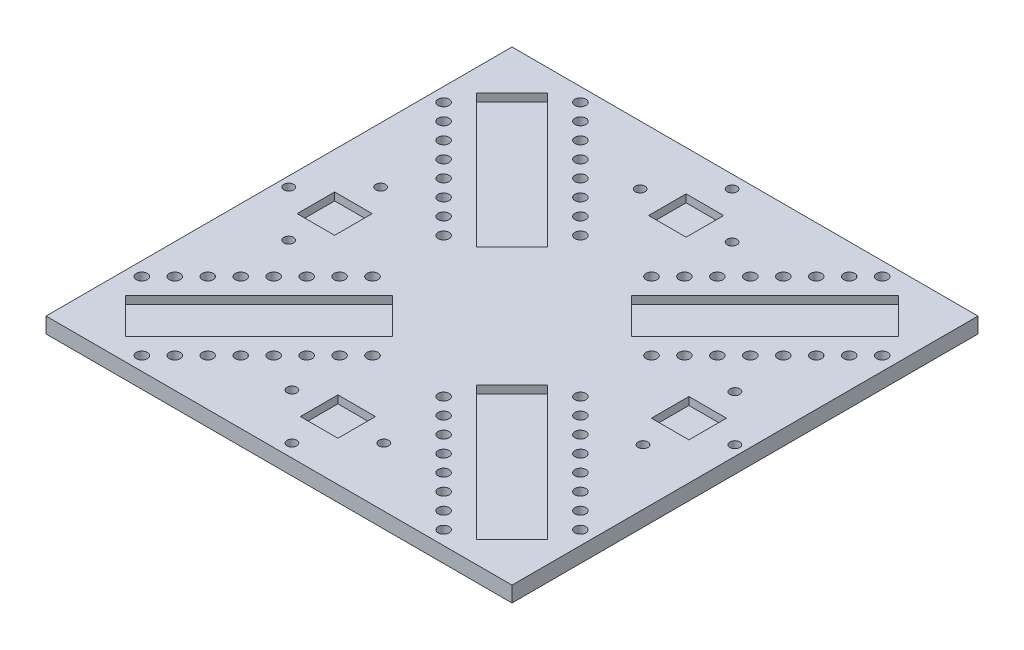
from build123d import *

# Parameters (mm, degrees)
SKETCH1_W           = 381
SKETCH1_H           = 12.7
BOSS_EXTRUDE1_DEPTH = 381
CUT_EXTRUDE1_DEPTH  = 6.35
SKETCH3_R           = 4.5
CUT_EXTRUDE2_DEPTH  = 539.965017418
SKETCH4_W           = 30.7
SKETCH4_H           = 30.7
CUT_EXTRUDE3_DEPTH  = 6.35
SKETCH5_R           = 4
CUT_EXTRUDE4_DEPTH  = 539.965017418
SKETCH6_R           = 4.5
CUT_EXTRUDE5_DEPTH  = 6.35
SKETCH8_R           = 4.5
CUT_EXTRUDE6_DEPTH  = 539.965017418


with BuildPart() as part:
    # Sketch1 → Boss-Extrude1 (new body)
    with BuildSketch(Plane.XY):
        with Locations((190.5, 6.35)):
            Rectangle(SKETCH1_W, SKETCH1_H)
    extrude(amount=BOSS_EXTRUDE1_DEPTH)

    # Sketch2 → Cut-Extrude1 (cut)
    with BuildSketch(Plane(origin=(0, 12.7, 0), x_dir=(1, 0, 0), z_dir=(0, 1, 0))):
        Polygon((17.951803255, -334.056818716), (46.943181284, -363.048196745), (127.765486373, -282.225891656), (98.774108344, -253.234513627), align=None)
        Polygon((282.225891656, -253.234513627), (253.234513627, -282.225891656), (334.056818716, -363.048196745), (363.048196745, -334.056818716), align=None)
        Polygon((363.048196745, -46.943181284), (282.225891656, -127.765486373), (253.234513627, -98.774108344), (334.056818716, -17.951803255), align=None)
        Polygon((98.774108344, -127.765486373), (127.765486373, -98.774108344), (46.943181284, -17.951803255), (17.951803255, -46.943181284), align=None)
    extrude(amount=-CUT_EXTRUDE1_DEPTH, mode=Mode.SUBTRACT)

    # Sketch3 → Cut-Extrude2 (cut, through all)
    with BuildSketch(Plane(origin=(0, 12.7, 0), x_dir=(1, 0, 0), z_dir=(0, 1, 0))):
        with Locations(Location((121.030294282, -315.90185211, 0), (0, 0, 270))):
            Circle(SKETCH3_R)
        with Locations(Location((107.559910101, -329.372236291, 0), (0, 0, 90))):
            Circle(SKETCH3_R)
        with Locations(Location((67.148757556, -369.783388836, 0), (0, 0, 270))):
            Circle(SKETCH3_R)
        with Locations(Location((134.500678464, -302.431467928, 0), (0, 0, 90))):
            Circle(SKETCH3_R)
        with Locations(Location((80.619141738, -356.313004654, 0), (0, 0, 90))):
            Circle(SKETCH3_R)
        with Locations(Location((94.089525919, -342.842620473, 0), (0, 0, 270))):
            Circle(SKETCH3_R)
        with Locations(Location((11.216611164, -313.851242444, 0), (0, 0, 90))):
            Circle(SKETCH3_R)
        with Locations(Location((24.686995346, -300.380858262, 0), (0, 0, 270))):
            Circle(SKETCH3_R)
        with Locations(Location((38.157379527, -286.910474081, 0), (0, 0, 90))):
            Circle(SKETCH3_R)
        with Locations(Location((51.627763709, -273.440089899, 0), (0, 0, 270))):
            Circle(SKETCH3_R)
        with Locations(Location((65.09814789, -259.969705718, 0), (0, 0, 90))):
            Circle(SKETCH3_R)
        with Locations(Location((78.568532072, -246.499321536, 0), (0, 0, 270))):
            Circle(SKETCH3_R)
        with Locations(Location((246.499321536, -302.431467928, 0), (0, 0, 270))):
            Circle(SKETCH3_R)
        with Locations(Location((259.969705718, -315.90185211, 0), (0, 0, 90))):
            Circle(SKETCH3_R)
        with Locations(Location((273.440089899, -329.372236291, 0), (0, 0, 270))):
            Circle(SKETCH3_R)
        with Locations(Location((286.910474081, -342.842620473, 0), (0, 0, 90))):
            Circle(SKETCH3_R)
        with Locations(Location((300.380858262, -356.313004654, 0), (0, 0, 270))):
            Circle(SKETCH3_R)
        with Locations(Location((313.851242444, -369.783388836, 0), (0, 0, 90))):
            Circle(SKETCH3_R)
        with Locations(Location((369.783388836, -313.851242444, 0), (0, 0, 270))):
            Circle(SKETCH3_R)
        with Locations(Location((302.431467928, -246.499321536, 0), (0, 0, 90))):
            Circle(SKETCH3_R)
        with Locations(Location((315.90185211, -259.969705718, 0), (0, 0, 270))):
            Circle(SKETCH3_R)
        with Locations(Location((329.372236291, -273.440089899, 0), (0, 0, 90))):
            Circle(SKETCH3_R)
        with Locations(Location((342.842620473, -286.910474081, 0), (0, 0, 270))):
            Circle(SKETCH3_R)
        with Locations(Location((356.313004654, -300.380858262, 0), (0, 0, 90))):
            Circle(SKETCH3_R)
        with Locations(Location((134.500678464, -78.568532072, 0), (0, 0, 270))):
            Circle(SKETCH3_R)
        with Locations(Location((121.030294282, -65.09814789, 0), (0, 0, 90))):
            Circle(SKETCH3_R)
        with Locations(Location((107.559910101, -51.627763709, 0), (0, 0, 270))):
            Circle(SKETCH3_R)
        with Locations(Location((94.089525919, -38.157379527, 0), (0, 0, 90))):
            Circle(SKETCH3_R)
        with Locations(Location((80.619141738, -24.686995346, 0), (0, 0, 270))):
            Circle(SKETCH3_R)
        with Locations(Location((67.148757556, -11.216611164, 0), (0, 0, 90))):
            Circle(SKETCH3_R)
        with Locations(Location((78.568532072, -134.500678464, 0), (0, 0, 90))):
            Circle(SKETCH3_R)
        with Locations(Location((65.09814789, -121.030294282, 0), (0, 0, 270))):
            Circle(SKETCH3_R)
        with Locations(Location((51.627763709, -107.559910101, 0), (0, 0, 90))):
            Circle(SKETCH3_R)
        with Locations(Location((38.157379527, -94.089525919, 0), (0, 0, 270))):
            Circle(SKETCH3_R)
        with Locations(Location((24.686995346, -80.619141738, 0), (0, 0, 90))):
            Circle(SKETCH3_R)
        with Locations(Location((11.216611164, -67.148757556, 0), (0, 0, 270))):
            Circle(SKETCH3_R)
        with Locations(Location((356.313004654, -80.619141738, 0), (0, 0, 270))):
            Circle(SKETCH3_R)
        with Locations(Location((342.842620473, -94.089525919, 0), (0, 0, 90))):
            Circle(SKETCH3_R)
        with Locations(Location((329.372236291, -107.559910101, 0), (0, 0, 270))):
            Circle(SKETCH3_R)
        with Locations(Location((315.90185211, -121.030294282, 0), (0, 0, 90))):
            Circle(SKETCH3_R)
        with Locations(Location((302.431467928, -134.500678464, 0), (0, 0, 270))):
            Circle(SKETCH3_R)
        with Locations(Location((369.783388836, -67.148757556, 0), (0, 0, 90))):
            Circle(SKETCH3_R)
        with Locations(Location((313.851242444, -11.216611164, 0), (0, 0, 270))):
            Circle(SKETCH3_R)
        with Locations(Location((300.380858262, -24.686995346, 0), (0, 0, 90))):
            Circle(SKETCH3_R)
        with Locations(Location((286.910474081, -38.157379527, 0), (0, 0, 270))):
            Circle(SKETCH3_R)
        with Locations(Location((273.440089899, -51.627763709, 0), (0, 0, 90))):
            Circle(SKETCH3_R)
        with Locations(Location((259.969705718, -65.09814789, 0), (0, 0, 270))):
            Circle(SKETCH3_R)
        with Locations(Location((246.499321536, -78.568532072, 0), (0, 0, 90))):
            Circle(SKETCH3_R)
    extrude(amount=-CUT_EXTRUDE2_DEPTH, mode=Mode.SUBTRACT)

    # Sketch4 → Cut-Extrude3 (cut)
    with BuildSketch(Plane(origin=(0, 12.7, 0), x_dir=(1, 0, 0), z_dir=(0, 1, 0))):
        with Locations((335.15, -190.5)):
            Rectangle(SKETCH4_W, SKETCH4_H)
        with Locations((190.5, -48.15)):
            Rectangle(SKETCH4_W, SKETCH4_H)
        with Locations((190.5, -332.85)):
            Rectangle(SKETCH4_W, SKETCH4_H)
        with Locations((45.5, -190.5)):
            Rectangle(SKETCH4_W, SKETCH4_H)
    extrude(amount=-CUT_EXTRUDE3_DEPTH, mode=Mode.SUBTRACT)

    # Sketch5 → Cut-Extrude4 (cut, through all)
    with BuildSketch(Plane(origin=(0, 12.7, 0), x_dir=(1, 0, 0), z_dir=(0, 1, 0))):
        with Locations(Location((335.15, -152.925, 0), (0, 0, 270))):
            Circle(SKETCH5_R)
        with Locations(Location((335.15, -228.075, 0), (0, 0, 90))):
            Circle(SKETCH5_R)
        with Locations(Location((228.075, -48.15, 0), (0, 0, 270))):
            Circle(SKETCH5_R)
        with Locations(Location((152.925, -48.15, 0), (0, 0, 90))):
            Circle(SKETCH5_R)
        with Locations(Location((372.725, -190.5, 0), (0, 0, 270))):
            Circle(SKETCH5_R)
        with Locations(Location((190.5, -10.575, 0), (0, 0, 270))):
            Circle(SKETCH5_R)
        with Locations(Location((228.075, -332.85, 0), (0, 0, 90))):
            Circle(SKETCH5_R)
        with Locations(Location((152.925, -332.85, 0), (0, 0, 270))):
            Circle(SKETCH5_R)
        with Locations(Location((190.5, -370.425, 0), (0, 0, 90))):
            Circle(SKETCH5_R)
        with Locations(Location((45.5, -152.925, 0), (0, 0, 270))):
            Circle(SKETCH5_R)
        with Locations(Location((7.925, -190.5, 0), (0, 0, 270))):
            Circle(SKETCH5_R)
        with Locations(Location((45.5, -228.075, 0), (0, 0, 90))):
            Circle(SKETCH5_R)
    extrude(amount=-CUT_EXTRUDE4_DEPTH, mode=Mode.SUBTRACT)

    # Sketch6 → Cut-Extrude5 (cut)
    with BuildSketch(Plane(origin=(0, 12.7, 0), x_dir=(1, 0, 0), z_dir=(0, 1, 0))):
        with Locations(Location((147.971062646, -288.961083746, 0), (0, 0, 90))):
            Circle(SKETCH6_R)
        with Locations(Location((161.441446827, -275.490699565, 0), (0, 0, 270))):
            Circle(SKETCH6_R)
        with Locations(Location((105.509300435, -219.558553173, 0), (0, 0, 90))):
            Circle(SKETCH6_R)
        with Locations(Location((92.038916254, -233.028937354, 0), (0, 0, 270))):
            Circle(SKETCH6_R)
        with Locations(Location((219.558553173, -275.490699565, 0), (0, 0, 90))):
            Circle(SKETCH6_R)
        with Locations(Location((233.028937354, -288.961083746, 0), (0, 0, 270))):
            Circle(SKETCH6_R)
        with Locations(Location((275.490699565, -219.558553173, 0), (0, 0, 270))):
            Circle(SKETCH6_R)
        with Locations(Location((288.961083746, -233.028937354, 0), (0, 0, 90))):
            Circle(SKETCH6_R)
        with Locations(Location((275.490699565, -161.441446827, 0), (0, 0, 90))):
            Circle(SKETCH6_R)
        with Locations(Location((288.961083746, -147.971062646, 0), (0, 0, 270))):
            Circle(SKETCH6_R)
        with Locations(Location((233.028937354, -92.038916254, 0), (0, 0, 90))):
            Circle(SKETCH6_R)
        with Locations(Location((219.558553173, -105.509300435, 0), (0, 0, 270))):
            Circle(SKETCH6_R)
        with Locations(Location((161.441446827, -105.509300435, 0), (0, 0, 90))):
            Circle(SKETCH6_R)
        with Locations(Location((147.971062646, -92.038916254, 0), (0, 0, 270))):
            Circle(SKETCH6_R)
        with Locations(Location((105.509300435, -161.441446827, 0), (0, 0, 270))):
            Circle(SKETCH6_R)
        with Locations(Location((92.038916254, -147.971062646, 0), (0, 0, 90))):
            Circle(SKETCH6_R)
        Polygon((98.774108344, -253.234513627), (127.058379592, -224.950242379), (156.049757621, -253.941620408), (127.765486373, -282.225891656), align=None)
        Polygon((282.225891656, -253.234513627), (253.941620408, -224.950242379), (224.950242379, -253.941620408), (253.234513627, -282.225891656), align=None)
        Polygon((282.225891656, -127.765486373), (253.234513627, -98.774108344), (224.950242379, -127.058379592), (253.941620408, -156.049757621), align=None)
        Polygon((98.774108344, -127.765486373), (127.058379592, -156.049757621), (156.049757621, -127.058379592), (127.765486373, -98.774108344), align=None)
    extrude(amount=-CUT_EXTRUDE5_DEPTH, mode=Mode.SUBTRACT)

    # Sketch8 → Cut-Extrude6 (cut, through all)
    with BuildSketch(Plane(origin=(0, 12.7, 0), x_dir=(1, 0, 0), z_dir=(0, 1, 0))):
        with Locations(Location((161.441446827, -275.490699565, 0), (0, 0, 270))):
            Circle(SKETCH8_R)
        with Locations(Location((147.971062646, -288.961083746, 0), (0, 0, 270))):
            Circle(SKETCH8_R)
        with Locations(Location((105.509300435, -219.558553173, 0), (0, 0, 270))):
            Circle(SKETCH8_R)
        with Locations(Location((92.038916254, -233.028937354, 0), (0, 0, 270))):
            Circle(SKETCH8_R)
        with Locations(Location((233.028937354, -288.961083746, 0), (0, 0, 270))):
            Circle(SKETCH8_R)
        with Locations(Location((219.558553173, -275.490699565, 0), (0, 0, 90))):
            Circle(SKETCH8_R)
        with Locations(Location((275.490699565, -219.558553173, 0), (0, 0, 270))):
            Circle(SKETCH8_R)
        with Locations(Location((288.961083746, -233.028937354, 0), (0, 0, 90))):
            Circle(SKETCH8_R)
        with Locations(Location((288.961083746, -147.971062646, 0), (0, 0, 270))):
            Circle(SKETCH8_R)
        with Locations(Location((275.490699565, -161.441446827, 0), (0, 0, 270))):
            Circle(SKETCH8_R)
        with Locations(Location((219.558553173, -105.509300435, 0), (0, 0, 270))):
            Circle(SKETCH8_R)
        with Locations(Location((233.028937354, -92.038916254, 0), (0, 0, 270))):
            Circle(SKETCH8_R)
        with Locations(Location((92.038916254, -147.971062646, 0), (0, 0, 90))):
            Circle(SKETCH8_R)
        with Locations(Location((105.509300435, -161.441446827, 0), (0, 0, 270))):
            Circle(SKETCH8_R)
        with Locations(Location((147.971062646, -92.038916254, 0), (0, 0, 270))):
            Circle(SKETCH8_R)
        with Locations(Location((161.441446827, -105.509300435, 0), (0, 0, 90))):
            Circle(SKETCH8_R)
    extrude(amount=-CUT_EXTRUDE6_DEPTH, mode=Mode.SUBTRACT)


solid = part.part
